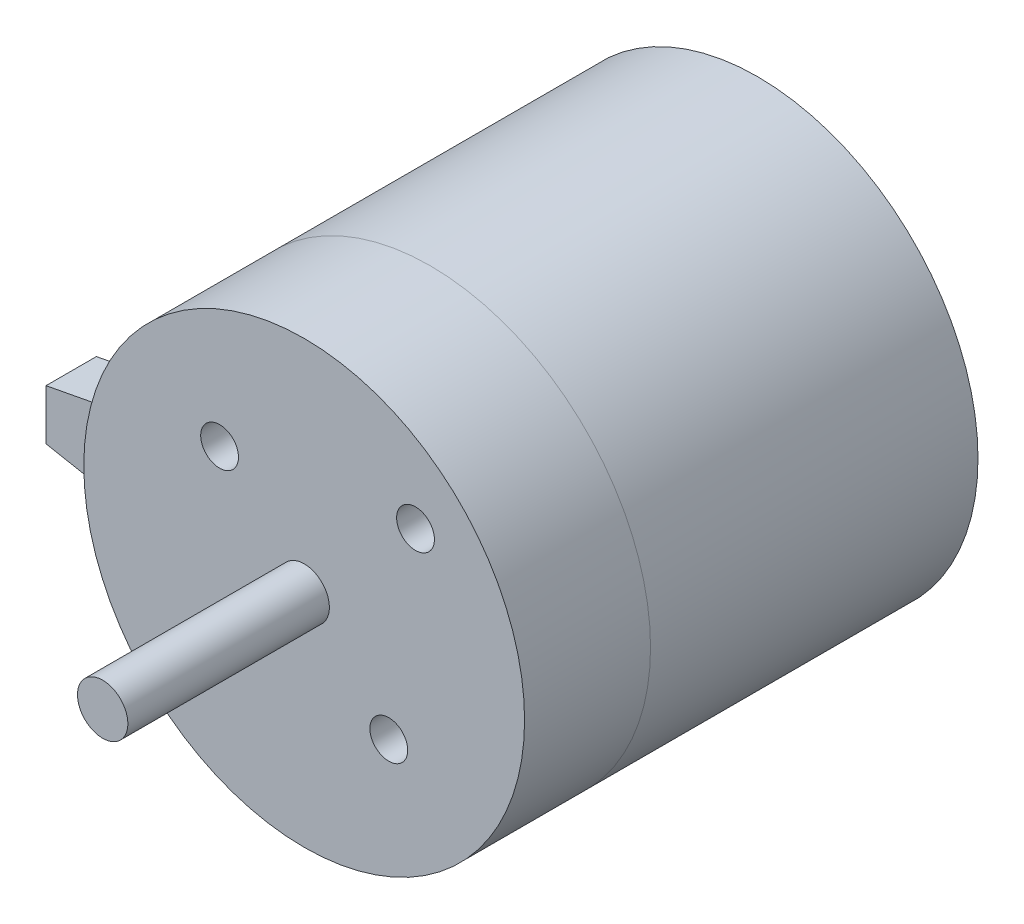
from build123d import *

# Parameters (mm, degrees)
SKETCH3_R           = 17.5
SKETCH3_R_2         = 1.25
SKETCH3_R_3         = 5.5
SKETCH3_R_4         = 2
BOSS_EXTRUDE2_DEPTH = 36
BOSS_EXTRUDE3_START = 36
SKETCH3_4_R         = 2
BOSS_EXTRUDE3_DEPTH = 16
BOSS_EXTRUDE4_START = -2
SKETCH3_5_R         = 5.5
SKETCH3_5_R_2       = 2
BOSS_EXTRUDE4_DEPTH = 2
SKETCH3_8_R         = 1.25
CUT_EXTRUDE1_DEPTH  = 3.5
CUT_EXTRUDE2_START  = 36
BASE_R              = 1.5
CUT_EXTRUDE2_DEPTH  = 3
BOSS_EXTRUDE5_START = 30
BOSS_EXTRUDE5_DEPTH = 4


with BuildPart() as part:
    # Sketch3 → Boss-Extrude2 (new body)
    # profile 1 of 6: a face of its own
    with BuildSketch(Plane.XY):
        Circle(SKETCH3_R)
        with Locations((-6.495190528, -3.75)):
            Circle(SKETCH3_R_2, mode=Mode.SUBTRACT)
        with Locations((6.495190528, -3.75)):
            Circle(SKETCH3_R_2, mode=Mode.SUBTRACT)
        with Locations((0, 7.5)):
            Circle(SKETCH3_R_2, mode=Mode.SUBTRACT)
        Circle(SKETCH3_R_3, mode=Mode.SUBTRACT)
    # profile 2 of 6: a face of its own
    with BuildSketch(Plane.XY):
        with Locations((0, 7.5)):
            Circle(SKETCH3_R_2)
    # profile 3 of 6: a face of its own
    with BuildSketch(Plane.XY):
        Circle(SKETCH3_R_3)
        Circle(SKETCH3_R_4, mode=Mode.SUBTRACT)
    # profile 4 of 6: a face of its own
    with BuildSketch(Plane.XY):
        Circle(SKETCH3_R_4)
    # profile 5 of 6: a face of its own
    with BuildSketch(Plane.XY):
        with Locations((-6.495190528, -3.75)):
            Circle(SKETCH3_R_2)
    # profile 6 of 6: a face of its own
    with BuildSketch(Plane.XY):
        with Locations((6.495190528, -3.75)):
            Circle(SKETCH3_R_2)
    extrude(amount=BOSS_EXTRUDE2_DEPTH)

    # Sketch3<4> → Boss-Extrude3 (add)
    with BuildSketch(Plane.XY.offset(BOSS_EXTRUDE3_START)):
        Circle(SKETCH3_4_R)
    extrude(amount=BOSS_EXTRUDE3_DEPTH)

    # Sketch3<5> → Boss-Extrude4 (add)
    with BuildSketch(Plane.XY.offset(BOSS_EXTRUDE4_START)):
        Circle(SKETCH3_5_R)
        Circle(SKETCH3_5_R_2, mode=Mode.SUBTRACT)
    extrude(amount=BOSS_EXTRUDE4_DEPTH)

    # Sketch3<8> → Cut-Extrude1 (cut)
    with BuildSketch(Plane.XY):
        with Locations((0, 7.5)):
            Circle(SKETCH3_8_R)
        with Locations((6.495190528, -3.75)):
            Circle(SKETCH3_8_R)
        with Locations((-6.495190528, -3.75)):
            Circle(SKETCH3_8_R)
    extrude(amount=CUT_EXTRUDE1_DEPTH, mode=Mode.SUBTRACT)

    # Base → Cut-Extrude2 (cut)
    with BuildSketch(Plane.XY.offset(CUT_EXTRUDE2_START)):
        with Locations((8.838834765, 8.838834765)):
            Circle(BASE_R)
        with Locations((-6.717514421, 6.717514421)):
            Circle(BASE_R)
        with Locations((-8.838834765, -8.838834765)):
            Circle(BASE_R)
        with Locations((6.717514421, -6.717514421)):
            Circle(BASE_R)
    extrude(amount=-CUT_EXTRUDE2_DEPTH, mode=Mode.SUBTRACT)

    # Base<4> → Boss-Extrude5 (add)
    with BuildSketch(Plane.XY.offset(BOSS_EXTRUDE5_START)):
        with BuildLine():
            ThreePointArc((-17.24093965, -3), (-17.5, 0), (-17.24093965, 3))
            Line((-17.24093965, 3), (-22.5, 2))
            Line((-22.5, 2), (-22.5, -2))
            Line((-22.5, -2), (-17.24093965, -3))
        make_face()
    extrude(amount=BOSS_EXTRUDE5_DEPTH)


solid = part.part
